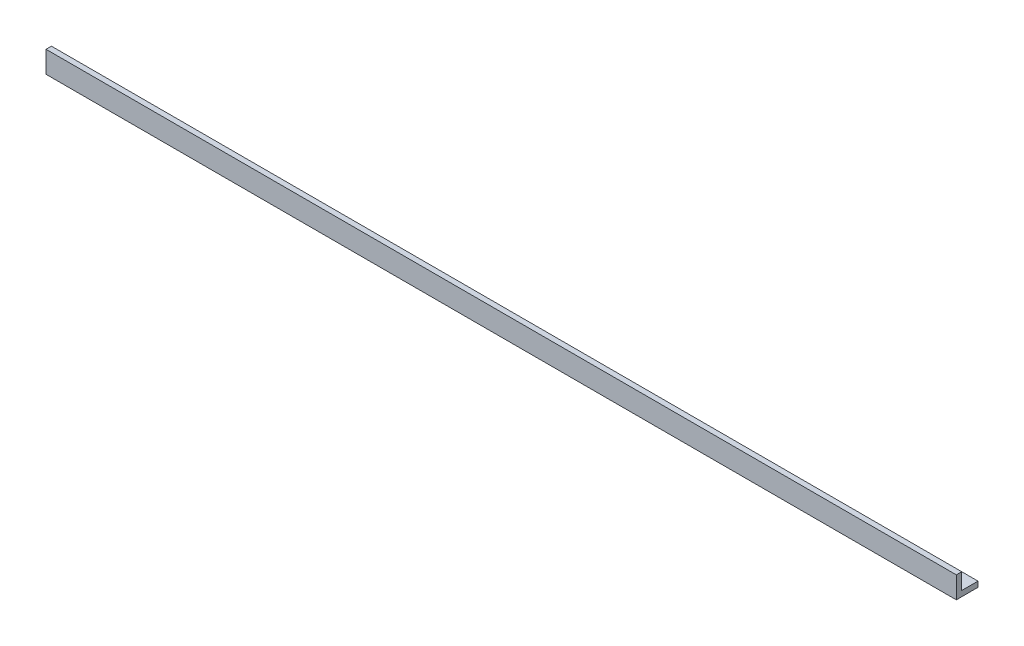
from build123d import *

# Parameters (mm, degrees)
BOSS_EXTRUDE1_DEPTH      = 533.4
BOSS_EXTRUDE1_DEPTH_BACK = 533.4


with BuildPart() as part:
    # Sketch1 → Boss-Extrude1 (new, two sides: drawn at the far end of the back side and taken through both)
    with BuildSketch(Plane(origin=(0, 0, 0), x_dir=(0, 0, -1), z_dir=(1, 0, 0)).offset(-BOSS_EXTRUDE1_DEPTH_BACK)):
        Polygon((6.35, 25.4), (0, 25.4), (0, 0), (25.4, 0), (25.4, 6.35), (6.35, 6.35), align=None)
    extrude(amount=BOSS_EXTRUDE1_DEPTH + BOSS_EXTRUDE1_DEPTH_BACK)


solid = part.part
